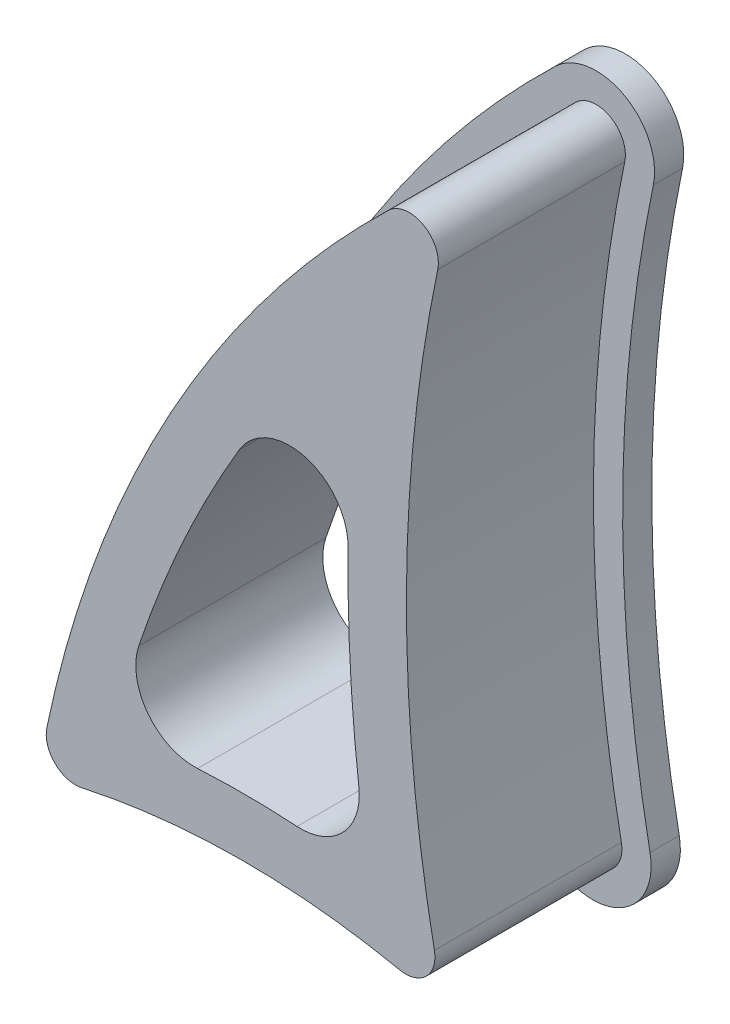
from build123d import *

# Parameters (mm, degrees)
EXTRUDE_1_DEPTH = 6.4
EXTRUDE_2_DEPTH = 1


with BuildPart() as part:
    # 草图1 → 凸台-拉伸1 (new body)
    with BuildSketch(Plane.XY):
        with BuildLine():
            ThreePointArc((-1.607555315, 23.253403092), (-2.102834102, 24.33260587), (-3.280118278, 24.177745667))
            ThreePointArc((-3.280118278, 24.177745667), (-10.73316918, 14.464202841), (-14.985773436, 2.983077502))
            ThreePointArc((-14.985773436, 2.983077502), (-14.710247084, 2.069013261), (-13.793473674, 1.802639986))
            ThreePointArc((-13.793473674, 1.802639986), (-8.353711957, 2.400269849), (-2.909355589, 1.846056223))
            ThreePointArc((-2.909355589, 1.846056223), (-2.001398399, 2.113095791), (-1.722710728, 3.017545663))
            ThreePointArc((-1.722710728, 3.017545663), (-2.678876467, 13.141243248), (-1.607555315, 23.253403092))
        make_face()
        with BuildLine():
            ThreePointArc((-11.838265008, 6.985769863), (-10.31805168, 10.845138893), (-8.396540596, 14.521220098))
            ThreePointArc((-8.396540596, 14.521220098), (-6.135950273, 15.427541437), (-4.675992097, 13.478128935))
            ThreePointArc((-4.675992097, 13.478128935), (-4.604024648, 10.019753035), (-4.3066146, 6.573437547))
            ThreePointArc((-4.3066146, 6.573437547), (-4.841051661, 4.960613716), (-6.423033433, 4.340809432))
            ThreePointArc((-6.423033433, 4.340809432), (-8.12545588, 4.400199712), (-9.828339295, 4.355956396))
            ThreePointArc((-9.828339295, 4.355956396), (-11.530116514, 5.138298702), (-11.838265008, 6.985769863))
        make_face(mode=Mode.SUBTRACT)
    extrude(amount=EXTRUDE_1_DEPTH)


with BuildPart() as body_2:
    # 草图1<5> → 凸台-拉伸2 (new body)
    with BuildSketch(Plane.XY):
        with BuildLine():
            ThreePointArc((-15.964862672, 3.186508738), (-15.413809968, 1.358380256), (-13.580263148, 0.825633706))
            ThreePointArc((-13.580263148, 0.825633706), (-8.349723035, 1.400277805), (-3.11476499, 0.867380088))
            ThreePointArc((-3.11476499, 0.867380088), (-1.29885061, 1.401459224), (-0.741475267, 3.210358968))
            ThreePointArc((-0.741475267, 3.210358968), (-1.678892658, 13.135552679), (-0.628577803, 23.049434879))
            ThreePointArc((-0.628577803, 23.049434879), (-1.619135377, 25.207840435), (-3.97370373, 24.898120029))
            ThreePointArc((-3.97370373, 24.898120029), (-11.608536362, 14.947661524), (-15.964862672, 3.186508738))
        make_face()
        with BuildLine():
            ThreePointArc((-14.985773436, 2.983077502), (-10.73316918, 14.464202841), (-3.280118278, 24.177745667))
            ThreePointArc((-3.280118278, 24.177745667), (-2.102834102, 24.33260587), (-1.607555315, 23.253403092))
            ThreePointArc((-1.607555315, 23.253403092), (-2.678876467, 13.141243248), (-1.722710728, 3.017545663))
            ThreePointArc((-1.722710728, 3.017545663), (-2.001398399, 2.113095791), (-2.909355589, 1.846056223))
            ThreePointArc((-2.909355589, 1.846056223), (-8.353711957, 2.400269849), (-13.793473674, 1.802639986))
            ThreePointArc((-13.793473674, 1.802639986), (-14.710247084, 2.069013261), (-14.985773436, 2.983077502))
        make_face(mode=Mode.SUBTRACT)
    extrude(amount=-EXTRUDE_2_DEPTH)


solid = Compound([part.part, body_2.part])
